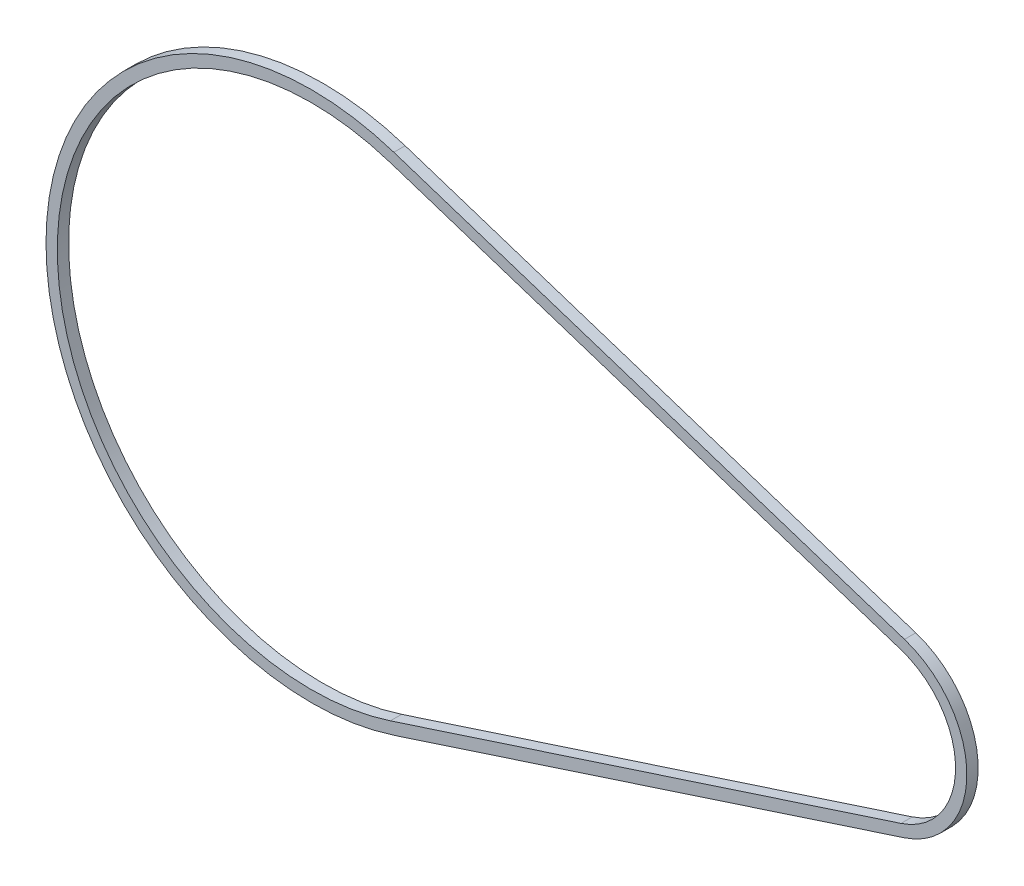
from build123d import *

# Parameters (mm, degrees)
BOSS_EXTRUDE2_DEPTH = 10


with BuildPart() as part:
    # Sketch1 → Boss-Extrude2 (new body)
    with BuildSketch(Plane.XY):
        with BuildLine():
            Line((72.85, 223.423090794), (524.8, 76.058924526))
            ThreePointArc((524.8, 76.058924526), (580, 0), (524.8, -76.058924526))
            Line((524.8, -76.058924526), (72.85, -223.423090794))
            ThreePointArc((72.85, -223.423090794), (-235, 0), (72.85, 223.423090794))
        make_face()
        with BuildLine():
            Line((69.75, -213.915725228), (521.7, -66.55155896))
            ThreePointArc((521.7, -66.55155896), (570, 0), (521.7, 66.55155896))
            Line((521.7, 66.55155896), (69.75, 213.915725228))
            ThreePointArc((69.75, 213.915725228), (-225, 0), (69.75, -213.915725228))
        make_face(mode=Mode.SUBTRACT)
    extrude(amount=BOSS_EXTRUDE2_DEPTH)


solid = part.part
